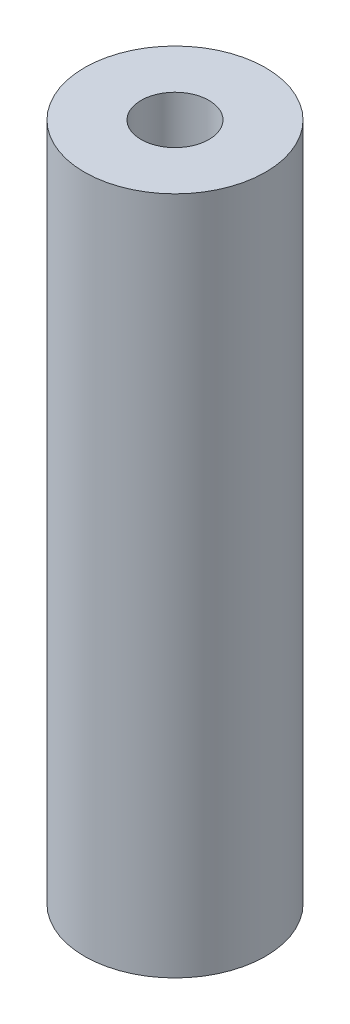
from build123d import *

# Parameters (mm, degrees)
SKETCH1_R           = 4
SKETCH1_R_2         = 1.5
BOSS_EXTRUDE1_DEPTH = 30


with BuildPart() as part:
    # Sketch1 → Boss-Extrude1 (new body)
    with BuildSketch(Plane(origin=(0, 0, 0), x_dir=(1, 0, 0), z_dir=(0, 1, 0))):
        with Locations(Location((0, 0, 0), (0, 0, 270))):
            Circle(SKETCH1_R)
        with Locations(Location((0, 0, 0), (0, 0, 270))):
            Circle(SKETCH1_R_2, mode=Mode.SUBTRACT)
    extrude(amount=BOSS_EXTRUDE1_DEPTH)


solid = part.part
